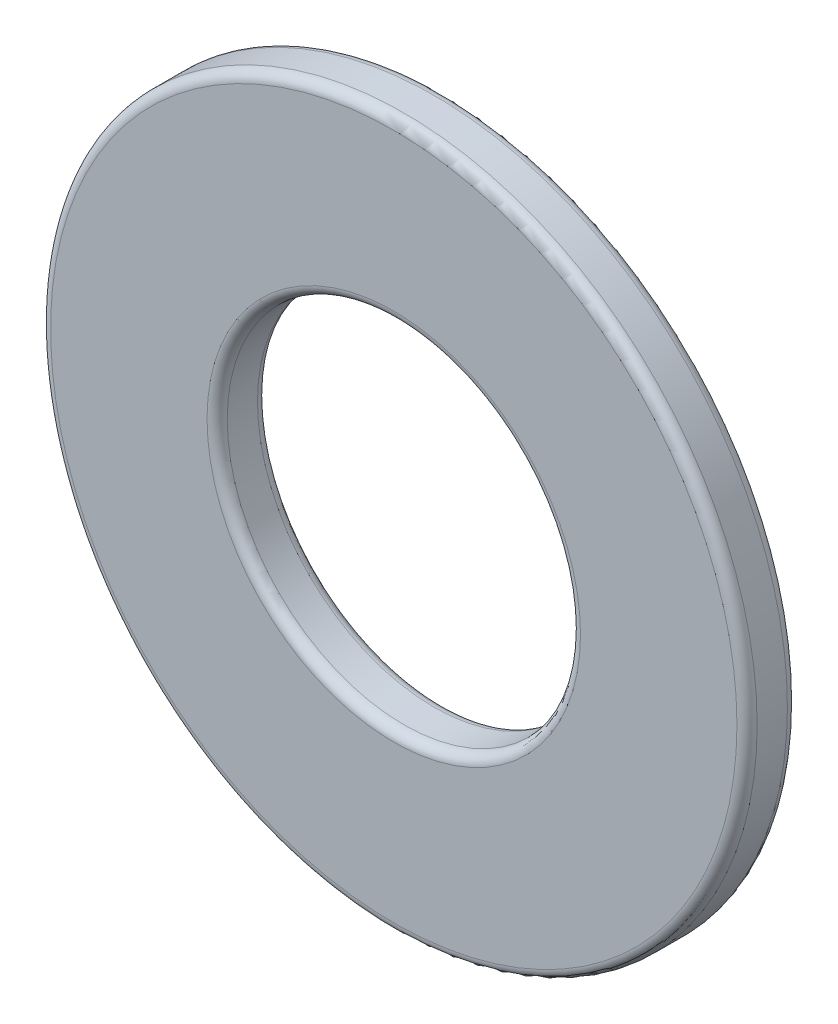
from build123d import *

# Parameters (mm, degrees)
ESQUISSE1_R        = 7
ESQUISSE1_R_2      = 3.5
BOSS_EXTRU_1_DEPTH = 1
CONG_1_R           = 0.2
CONG_2_R           = 0.2


with BuildPart() as part:
    # Esquisse1 → Boss.-Extru.1 (new body)
    with BuildSketch(Plane.XY):
        Circle(ESQUISSE1_R)
        Circle(ESQUISSE1_R_2, mode=Mode.SUBTRACT)
    extrude(amount=BOSS_EXTRU_1_DEPTH)

    # Congé1
    cong_1_edges = [part.edges().sort_by_distance(p)[0] for p in [
        (-7, 0, 0),
        (-7, 0, 1),
        (-3.5, 0, 1),
    ]]
    fillet(cong_1_edges, radius=CONG_1_R)

    # Congé2
    cong_2_edges = [part.edges().sort_by_distance(p)[0] for p in [
        (-3.5, 0, 0),
    ]]
    fillet(cong_2_edges, radius=CONG_2_R)


solid = part.part
